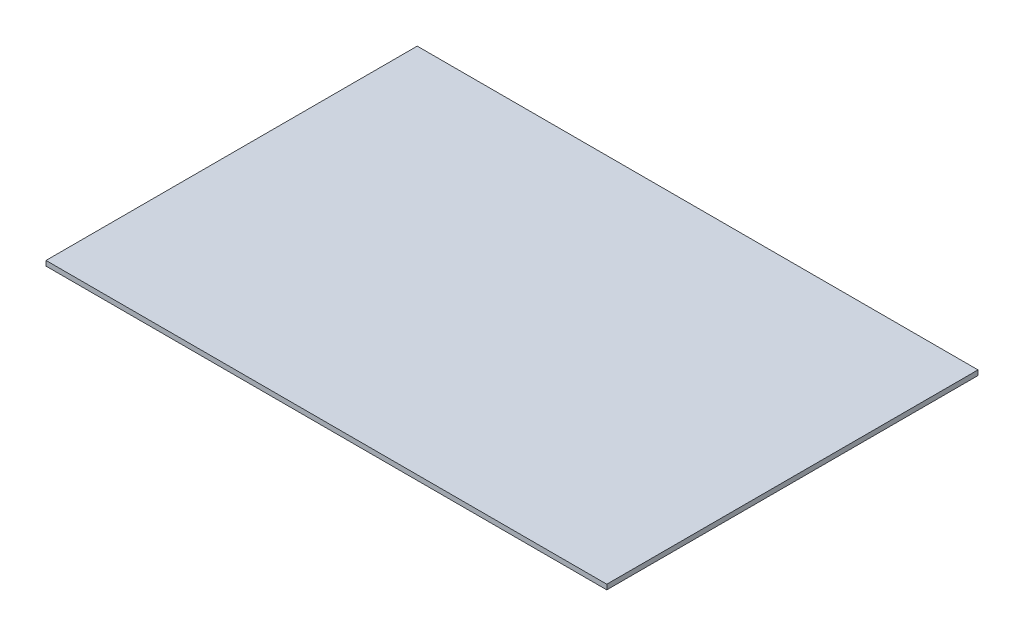
from build123d import *

# Parameters (mm, degrees)
SKETCH2_W           = 901.7
SKETCH2_H           = 596.9
BOSS_EXTRUDE2_DEPTH = 7.9375


with BuildPart() as part:
    # Sketch2 → Boss-Extrude2 (new body)
    with BuildSketch(Plane(origin=(0, 0, 0), x_dir=(1, 0, 0), z_dir=(0, 1, 0))):
        with Locations((450.85, 298.45)):
            Rectangle(SKETCH2_W, SKETCH2_H)
    extrude(amount=BOSS_EXTRUDE2_DEPTH)


solid = part.part
